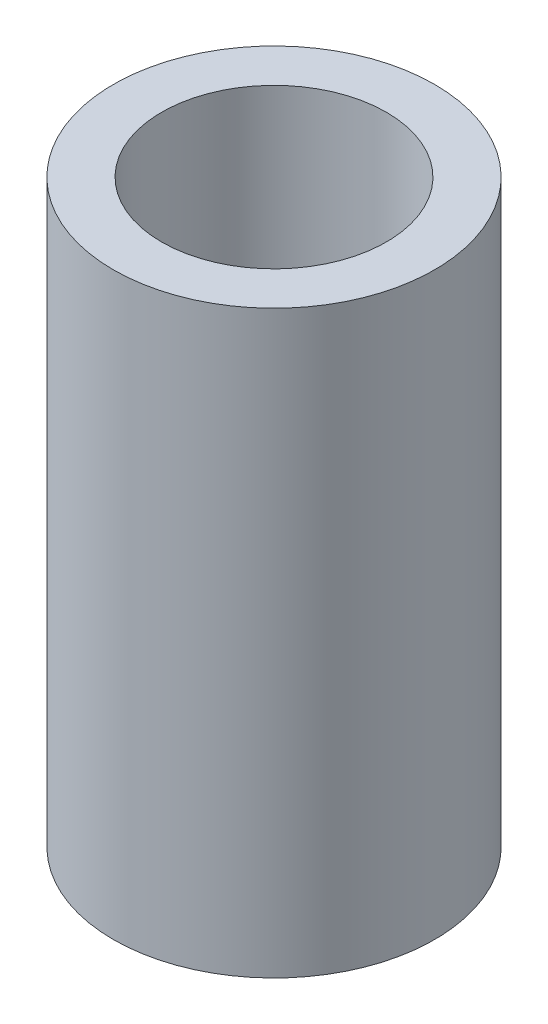
from build123d import *

# Parameters (mm, degrees)
SKETCH1_R           = 2.8575
SKETCH1_R_2         = 2
BOSS_EXTRUDE1_DEPTH = 10.32


with BuildPart() as part:
    # Sketch1 → Boss-Extrude1 (new body)
    with BuildSketch(Plane(origin=(0, 0, 0), x_dir=(1, 0, 0), z_dir=(0, 1, 0))):
        with Locations(Location((0, 0, 0), (0, 0, 270))):
            Circle(SKETCH1_R)
        with Locations(Location((0, 0, 0), (0, 0, 270))):
            Circle(SKETCH1_R_2, mode=Mode.SUBTRACT)
    extrude(amount=-BOSS_EXTRUDE1_DEPTH)


solid = part.part
